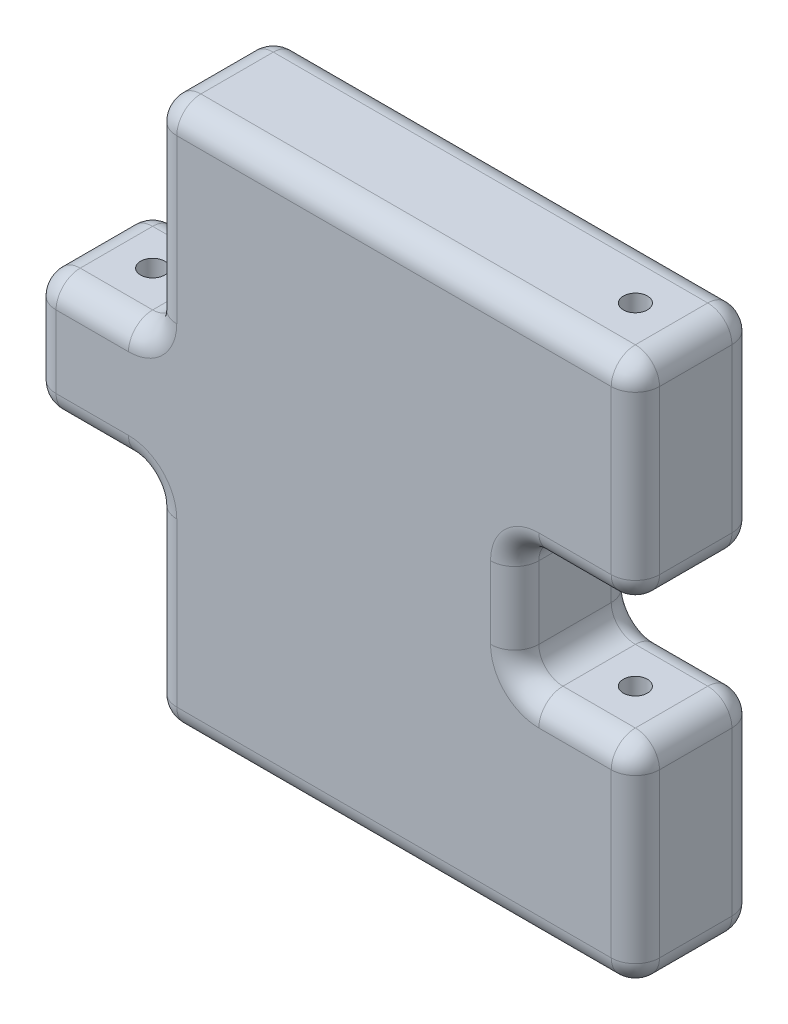
from build123d import *

# Parameters (mm, degrees)
BOSS_EXTRUDE1_DEPTH     = 10
FILLET1_R               = 2
CUT_EXTRUDE1_DEPTH      = 50.560569004
CUT_EXTRUDE1_DEPTH_BACK = 50.560569004
SKETCH2_R               = 1


with BuildPart() as part:
    # Sketch1 → Boss-Extrude1 (new body)
    with BuildSketch(Plane.XY):
        Polygon((10, 22.5), (-30, 22.5), (-30, 5), (-40, 5), (-40, -5), (-30, -5), (-30, -22.5), (10, -22.5), (10, -5), (0, -5), (0, 5), (10, 5), align=None)
    extrude(amount=BOSS_EXTRUDE1_DEPTH)

    # Fillet1
    fillet1_edges = [part.edges().sort_by_distance(p)[0] for p in [
        (-30, 13.75, 0),
        (-10, 22.5, 0),
        (-35, -5, 10),
        (10, 13.75, 0),
        (5, 5, 0),
        (0, 0, 0),
        (5, -5, 0),
        (10, -13.75, 0),
        (-10, -22.5, 0),
        (-30, -13.75, 0),
        (-35, -5, 0),
        (-40, 0, 0),
        (-35, 5, 0),
        (-30, -13.75, 10),
        (-30, 5, 5),
        (-30, 22.5, 5),
        (10, 22.5, 5),
        (-10, -22.5, 10),
        (10, 5, 5),
        (0, 5, 5),
        (0, -5, 5),
        (10, -5, 5),
        (10, -22.5, 5),
        (-30, -22.5, 5),
        (-30, -5, 5),
        (-40, -5, 5),
        (-40, 5, 5),
        (10, -13.75, 10),
        (5, -5, 10),
        (0, 0, 10),
        (5, 5, 10),
        (10, 13.75, 10),
        (-10, 22.5, 10),
        (-30, 13.75, 10),
        (-35, 5, 10),
        (-40, 0, 10),
    ]]
    fillet(fillet1_edges, radius=FILLET1_R)

    # Sketch2 → Cut-Extrude1 (cut, two sides: drawn at the far end of the back side and taken through both)
    with BuildSketch(Plane.XZ.offset(-5).offset(-CUT_EXTRUDE1_DEPTH_BACK)):
        with Locations(Location((5, 5, 0), (0, 0, 270))):
            Circle(SKETCH2_R)
        with Locations(Location((-35, 5, 0), (0, 0, 180))):
            Circle(SKETCH2_R)
    extrude(amount=CUT_EXTRUDE1_DEPTH + CUT_EXTRUDE1_DEPTH_BACK, mode=Mode.SUBTRACT)


solid = part.part
